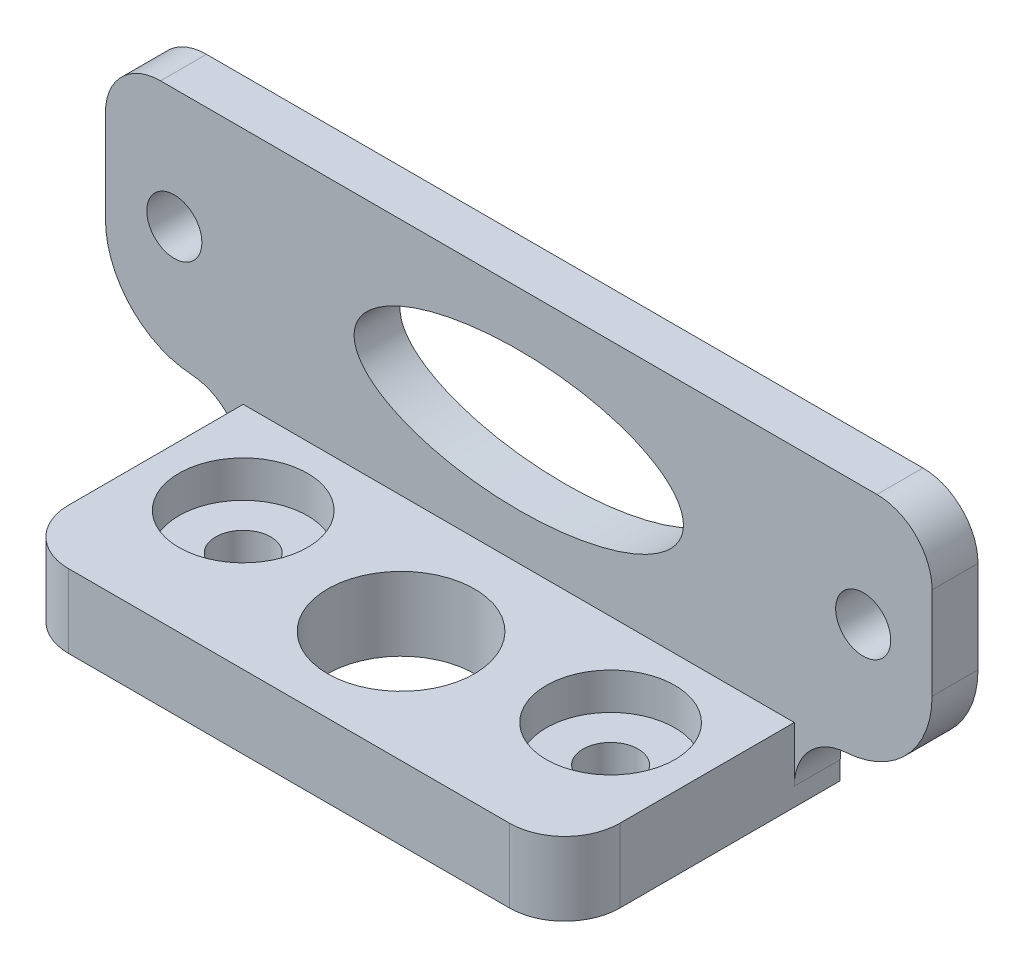
from build123d import *

# Parameters (mm, degrees)
SKETCH_1_W          = 30
SKETCH_1_H          = 15
EXTRUDE_1_DEPTH     = 4
SKETCH_2_W          = 45
SKETCH_2_H          = 2.5
EXTRUDE_2_DEPTH     = 13
SKETCH_3_R          = 1.5
CUT_EXTRUDE_1_DEPTH = 25
FILLET_1_R          = 3
SKETCH_4_R          = 1.5
CUT_EXTRUDE_2_DEPTH = 25
SKETCH_5_R          = 3.5
CUT_EXTRUDE_3_DEPTH = 2
FILLET_2_R          = 5
SKETCH_6_RX         = 8.962094073
SKETCH_6_RY         = 3.777931928
CUT_EXTRUDE_4_DEPTH = 10
SKETCH_7_R          = 4
CUT_EXTRUDE_5_DEPTH = 10


with BuildPart() as part:
    # 草图1 → 凸台-拉伸1 (new body)
    with BuildSketch(Plane(origin=(0, 0, 0), x_dir=(1, 0, 0), z_dir=(0, 1, 0))):
        Rectangle(SKETCH_1_W, SKETCH_1_H)
    extrude(amount=EXTRUDE_1_DEPTH)

    # 草图2 → 凸台-拉伸2 (add)
    with BuildSketch(Plane(origin=(0, 4, 0), x_dir=(1, 0, 0), z_dir=(0, 1, 0))):
        with Locations((0, 6.25)):
            Rectangle(SKETCH_2_W, SKETCH_2_H)
    extrude(amount=EXTRUDE_2_DEPTH)

    # 草图3 → 切除-拉伸1 (cut)
    with BuildSketch(Plane.XY.offset(-5)):
        with Locations((18.75, 10.5)):
            Circle(SKETCH_3_R)
        with Locations((-18.75, 10.5)):
            Circle(SKETCH_3_R)
    extrude(amount=-CUT_EXTRUDE_1_DEPTH, mode=Mode.SUBTRACT)

    # 圆角1
    fillet_1_edges = [part.edges().sort_by_distance(p)[0] for p in [
        (-15, 2, 7.5),
        (15, 2, 7.5),
        (15, 4, -6.25),
        (-15, 4, -6.25),
        (-22.5, 17, -6.25),
        (22.5, 17, -6.25),
    ]]
    fillet(fillet_1_edges, radius=FILLET_1_R)

    # 草图4 → 切除-拉伸2 (cut)
    with BuildSketch(Plane(origin=(0, 4, 0), x_dir=(1, 0, 0), z_dir=(0, 1, 0))):
        with Locations(Location((10, 0, 0), (0, 0, 270))):
            Circle(SKETCH_4_R)
        with Locations(Location((-10, 0, 0), (0, 0, 270))):
            Circle(SKETCH_4_R)
    extrude(amount=-CUT_EXTRUDE_2_DEPTH, mode=Mode.SUBTRACT)

    # 草图5 → 切除-拉伸3 (cut)
    with BuildSketch(Plane(origin=(0, 4, 0), x_dir=(1, 0, 0), z_dir=(0, 1, 0))):
        with Locations(Location((10, 0, 0), (0, 0, 270))):
            Circle(SKETCH_5_R)
        with Locations(Location((-10, 0, 0), (0, 0, 270))):
            Circle(SKETCH_5_R)
    extrude(amount=-CUT_EXTRUDE_3_DEPTH, mode=Mode.SUBTRACT)

    # 圆角2
    fillet_2_edges = [part.edges().sort_by_distance(p)[0] for p in [
        (-22.5, 4, -6.25),
        (22.5, 4, -6.25),
    ]]
    fillet(fillet_2_edges, radius=FILLET_2_R)

    # 草图6 → 切除-拉伸4 (cut)
    with BuildSketch(Plane.XY.offset(-5)):
        with Locations((0, 10.28402341)):
            Ellipse(SKETCH_6_RX, SKETCH_6_RY)
    extrude(amount=-CUT_EXTRUDE_4_DEPTH, mode=Mode.SUBTRACT)

    # 草图7 → 切除-拉伸5 (cut)
    with BuildSketch(Plane(origin=(0, 4, 0), x_dir=(1, 0, 0), z_dir=(0, 1, 0))):
        with Locations(Location((0, -1.406230218, 0), (0, 0, 270))):
            Circle(SKETCH_7_R)
    extrude(amount=-CUT_EXTRUDE_5_DEPTH, mode=Mode.SUBTRACT)


solid = part.part
